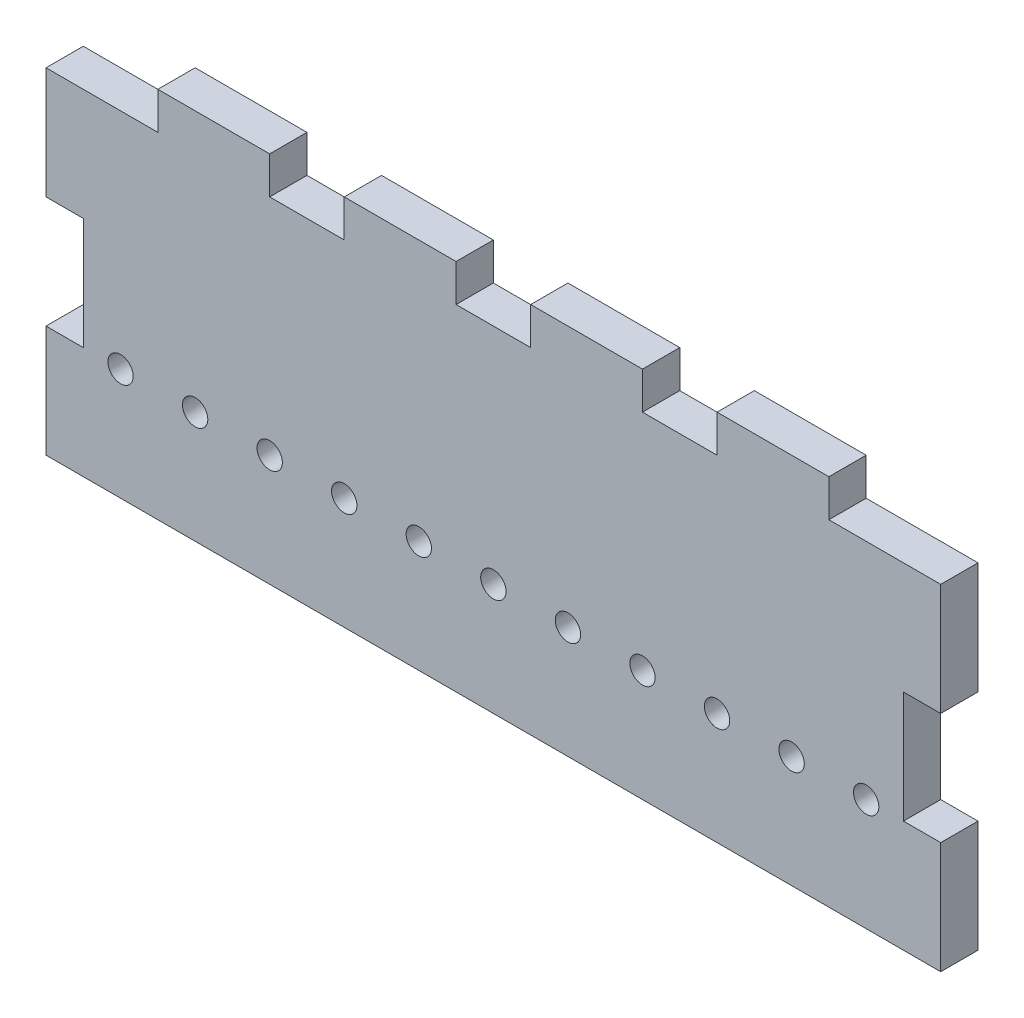
from build123d import *

# Parameters (mm, degrees)
SKETCH1_W            = 152.4
SKETCH1_H            = 63.5
BOSS_EXTRUDE1_DEPTH  = 3.175
SKETCH2_R            = 2.159
CUT_EXTRUDE1_DEPTH   = 83.793870546
LPATTERN1_COUNT      = 11
LPATTERN1_PITCH      = 12.7
LPATTERN1_COUNT_DIR2 = 11
LPATTERN1_PITCH_DIR2 = 12.7
SKETCH3_W            = 19.05
SKETCH3_H            = 6.35
CUT_EXTRUDE2_DEPTH   = 83.793870546
SKETCH4_W            = 12.7
SKETCH4_H            = 6.35
CUT_EXTRUDE3_DEPTH   = 83.793870546
LPATTERN2_COUNT      = 3
LPATTERN2_PITCH      = 31.75
SKETCH5_W            = 6.35
SKETCH5_H            = 19.05
CUT_EXTRUDE4_DEPTH   = 83.793870546


with BuildPart() as part:
    # Sketch1 → Boss-Extrude1 (new, symmetric)
    with BuildSketch(Plane.XY):
        Rectangle(SKETCH1_W, SKETCH1_H)
    extrude(amount=BOSS_EXTRUDE1_DEPTH, both=True)

    # Sketch2 → Cut-Extrude1 (cut, through all)
    with BuildSketch(Plane(origin=(0, 0, -3.175), x_dir=(-1, 0, 0), z_dir=(0, 0, -1))):
        with Locations((0, -12.7)):
            Circle(SKETCH2_R)
    cut_extrude1 = extrude(amount=-CUT_EXTRUDE1_DEPTH, mode=Mode.SUBTRACT)

    # LPattern1: Cut-Extrude1 11 × 11, 10 skipped
    with Locations(*[Vector(-1, 0, 0) * (i * LPATTERN1_PITCH) + Vector(1, 0, 0) * (j * LPATTERN1_PITCH_DIR2) for i in range(LPATTERN1_COUNT) for j in range(LPATTERN1_COUNT_DIR2) if (i, j) not in ((0, 0), (0, 6), (1, 7), (2, 8), (3, 9), (4, 10), (6, 0), (7, 1), (8, 2), (9, 3), (10, 4))]):
        add(cut_extrude1, mode=Mode.SUBTRACT)

    # Sketch3 → Cut-Extrude2 (cut, through all)
    with BuildSketch(Plane(origin=(0, 0, -3.175), x_dir=(-1, 0, 0), z_dir=(0, 0, -1))):
        with Locations((-66.675, 28.575)):
            Rectangle(SKETCH3_W, SKETCH3_H)
    cut_extrude2 = extrude(amount=-CUT_EXTRUDE2_DEPTH, mode=Mode.SUBTRACT)

    # Mirror1: Cut-Extrude2 across plane
    add(cut_extrude2.mirror(Plane(origin=(0, 0, 0), x_dir=(0, 0, 1), z_dir=(1, 0, 0))), mode=Mode.SUBTRACT)

    # Sketch4 → Cut-Extrude3 (cut, through all)
    with BuildSketch(Plane(origin=(0, 0, -3.175), x_dir=(-1, 0, 0), z_dir=(0, 0, -1))):
        with Locations((-31.75, 28.575)):
            Rectangle(SKETCH4_W, SKETCH4_H)
    cut_extrude3 = extrude(amount=-CUT_EXTRUDE3_DEPTH, mode=Mode.SUBTRACT)

    # LPattern2: Cut-Extrude3 ×3
    with Locations(*[(-i * LPATTERN2_PITCH, 0, 0) for i in range(1, LPATTERN2_COUNT)]):
        add(cut_extrude3, mode=Mode.SUBTRACT)

    # Sketch5 → Cut-Extrude4 (cut, through all)
    with BuildSketch(Plane(origin=(0, 0, -3.175), x_dir=(-1, 0, 0), z_dir=(0, 0, -1))):
        with Locations((-73.025, -3.175)):
            Rectangle(SKETCH5_W, SKETCH5_H)
    cut_extrude4 = extrude(amount=-CUT_EXTRUDE4_DEPTH, mode=Mode.SUBTRACT)

    # Mirror2: Cut-Extrude4 across plane
    add(cut_extrude4.mirror(Plane(origin=(0, 0, 0), x_dir=(0, 0, 1), z_dir=(1, 0, 0))), mode=Mode.SUBTRACT)


solid = part.part
